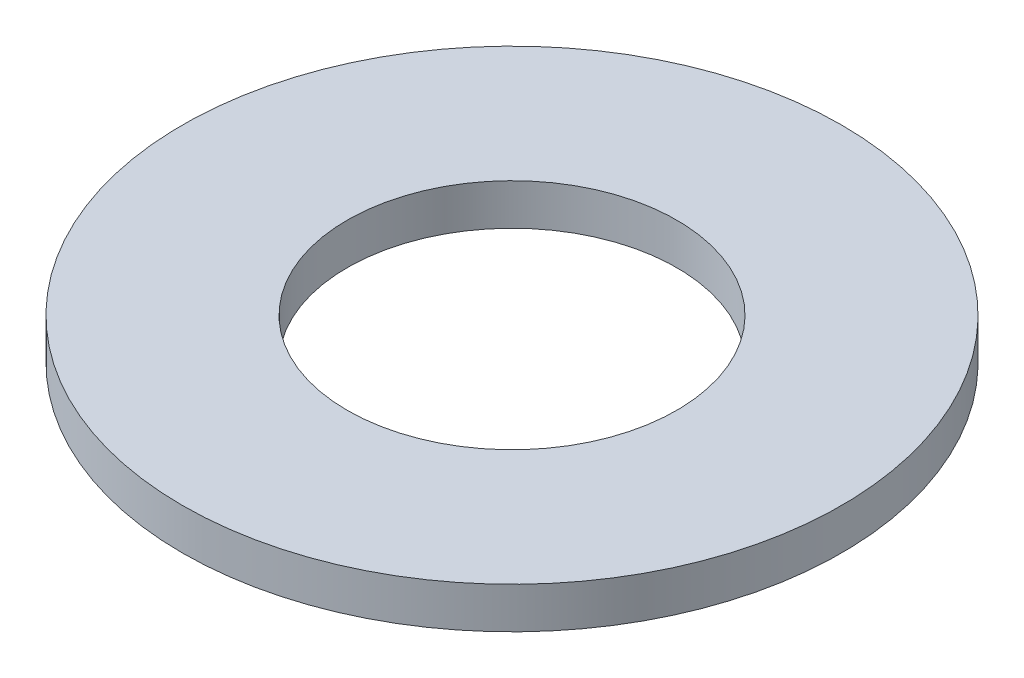
from build123d import *

# Parameters (mm, degrees)
SKETCH1_R           = 6.35
BOSS_EXTRUDE1_DEPTH = 0.79375
SKETCH2_R           = 3.175
CUT_EXTRUDE1_DEPTH  = 17.4625


with BuildPart() as part:
    # Sketch1 → Boss-Extrude1 (new body)
    with BuildSketch(Plane(origin=(0, 0, 0), x_dir=(1, 0, 0), z_dir=(0, 1, 0))):
        with Locations(Location((0, 0, 0), (0, 0, 270))):
            Circle(SKETCH1_R)
    extrude(amount=BOSS_EXTRUDE1_DEPTH)

    # Sketch2 → Cut-Extrude1 (cut)
    with BuildSketch(Plane(origin=(0, 0.79375, 0), x_dir=(1, 0, 0), z_dir=(0, 1, 0))):
        with Locations(Location((0, 0, 0), (0, 0, 270))):
            Circle(SKETCH2_R)
    extrude(amount=-CUT_EXTRUDE1_DEPTH, mode=Mode.SUBTRACT)


solid = part.part
